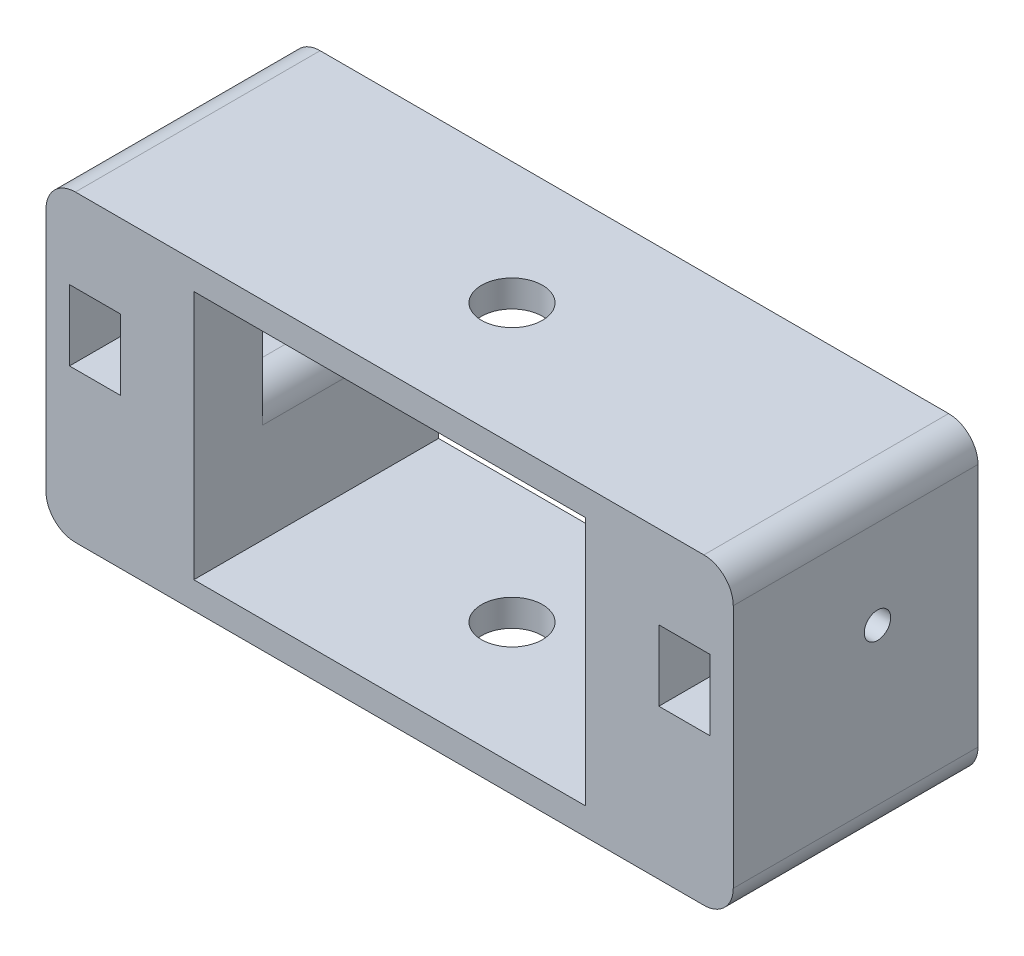
from build123d import *

# Parameters (mm, degrees)
SKETCH_1_W          = 70.2
SKETCH_1_H          = 31
EXTRUDE_1_DEPTH     = 25
SKETCH_2_W          = 40
SKETCH_2_H          = 25.5
CUT_EXTRUDE_1_DEPTH = 32
SKETCH_3_R          = 3.11
CUT_EXTRUDE_2_DEPTH = 41
SKETCH_4_W          = 5.2
SKETCH_4_H          = 7.2
CUT_EXTRUDE_3_DEPTH = 25
SKETCH_5_R          = 1.35
CUT_EXTRUDE_4_DEPTH = 122
FILLET_1_R          = 3
SKETCH_6_W          = 5.323047144
SKETCH_6_H          = 6
CUT_EXTRUDE_5_DEPTH = 18
FILLET_2_R          = 3


with BuildPart() as part:
    # 草图1 → 凸台-拉伸1 (new body)
    with BuildSketch(Plane.XY):
        Rectangle(SKETCH_1_W, SKETCH_1_H)
    extrude(amount=EXTRUDE_1_DEPTH)

    # 草图2 → 切除-拉伸1 (cut)
    with BuildSketch(Plane.XY.offset(25)):
        Rectangle(SKETCH_2_W, SKETCH_2_H)
    extrude(amount=-CUT_EXTRUDE_1_DEPTH, mode=Mode.SUBTRACT)

    # 草图3 → 切除-拉伸2 (cut)
    with BuildSketch(Plane.XZ.offset(15.5)):
        with Locations(Location((0, 12.5, 0), (0, 0, 270))):
            Circle(SKETCH_3_R)
    extrude(amount=-CUT_EXTRUDE_2_DEPTH, mode=Mode.SUBTRACT)

    # 草图4 → 切除-拉伸3 (cut)
    with BuildSketch(Plane(origin=(0, 0, 0), x_dir=(-1, 0, 0), z_dir=(0, 0, -1))):
        with Locations((30.1, 3.411480114)):
            Rectangle(SKETCH_4_W, SKETCH_4_H)
        with Locations((-30.1, 3.411480114)):
            Rectangle(SKETCH_4_W, SKETCH_4_H)
    extrude(amount=-CUT_EXTRUDE_3_DEPTH, mode=Mode.SUBTRACT)

    # 草图5 → 切除-拉伸4 (cut)
    with BuildSketch(Plane(origin=(35.1, 0, 0), x_dir=(0, 0, -1), z_dir=(1, 0, 0))):
        with Locations((-10.268877546, 3.411480114)):
            Circle(SKETCH_5_R)
    extrude(amount=-CUT_EXTRUDE_4_DEPTH, mode=Mode.SUBTRACT)

    # 圆角1
    fillet_1_edges = [part.edges().sort_by_distance(p)[0] for p in [
        (35.1, -15.5, 12.5),
        (-35.1, -15.5, 12.5),
        (-35.1, 15.5, 12.5),
        (35.1, 15.5, 12.5),
    ]]
    fillet(fillet_1_edges, radius=FILLET_1_R)

    # 草图6 → 切除-拉伸5 (cut)
    with BuildSketch(Plane(origin=(0, 0, 0), x_dir=(-1, 0, 0), z_dir=(0, 0, -1))):
        with Locations((-22.661523572, 3.411480114)):
            Rectangle(SKETCH_6_W, SKETCH_6_H)
        with Locations((22.661523572, 3.411480114)):
            Rectangle(SKETCH_6_W, SKETCH_6_H)
    extrude(amount=-CUT_EXTRUDE_5_DEPTH, mode=Mode.SUBTRACT)

    # 圆角2
    fillet_2_edges = [part.edges().sort_by_distance(p)[0] for p in [
        (20, 6.411480114, 9),
        (20, 0.411480114, 9),
        (-20, 0.411480114, 9),
        (-20, 6.411480114, 9),
    ]]
    fillet(fillet_2_edges, radius=FILLET_2_R)


solid = part.part
